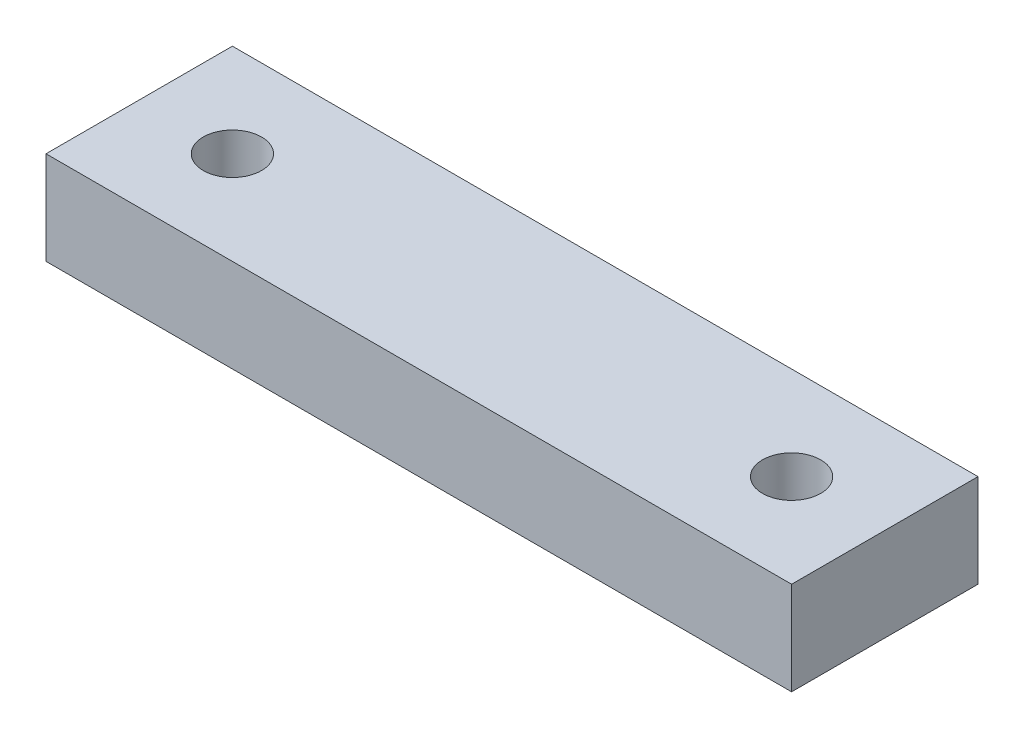
from build123d import *

# Parameters (mm, degrees)
SKETCH_1_W      = 32
SKETCH_1_H      = 8
SKETCH_1_R      = 1.25
EXTRUDE_1_DEPTH = 4


with BuildPart() as part:
    # Эскиз1 → Бобышка-Вытянуть1 (new body)
    with BuildSketch(Plane(origin=(0, 0, 0), x_dir=(1, 0, 0), z_dir=(0, 1, 0))):
        with Locations((16, 4)):
            Rectangle(SKETCH_1_W, SKETCH_1_H)
        with Locations(Location((4, 4, 0), (0, 0, 270))):
            Circle(SKETCH_1_R, mode=Mode.SUBTRACT)
        with Locations(Location((28, 4, 0), (0, 0, 90))):
            Circle(SKETCH_1_R, mode=Mode.SUBTRACT)
    extrude(amount=EXTRUDE_1_DEPTH)


solid = part.part
